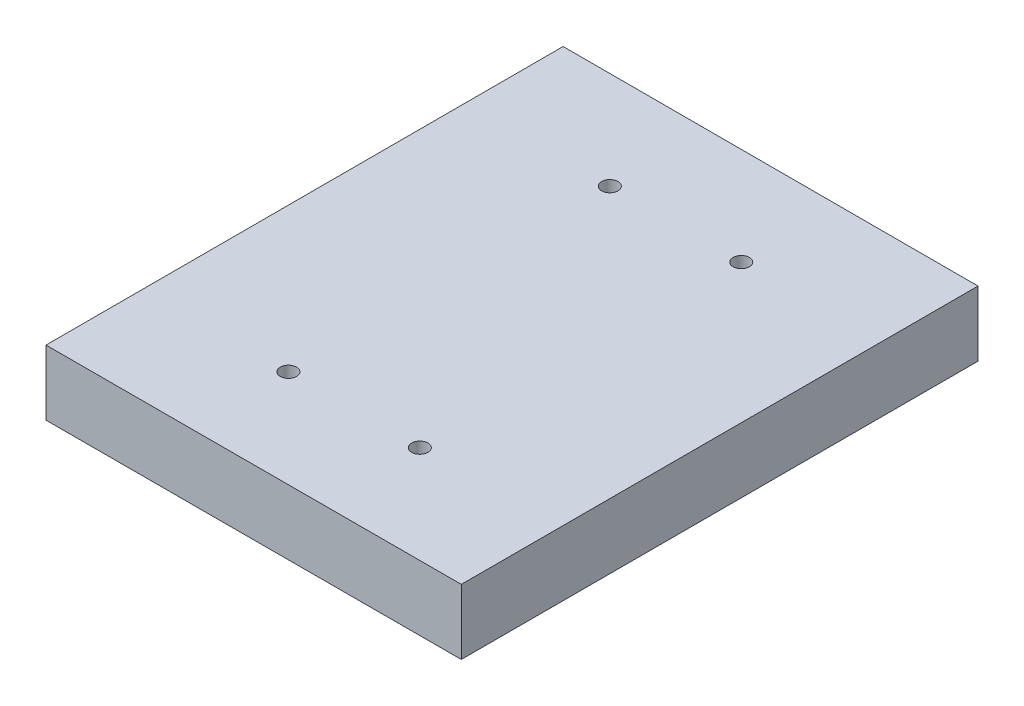
from build123d import *

# Parameters (mm, degrees)
SKETCH1_R           = 1.25
BOSS_EXTRUDE2_DEPTH = 10
SKETCH3_R           = 2.5
CUT_EXTRUDE2_DEPTH  = 2


with BuildPart() as part:
    # Sketch1 → Boss-Extrude2 (new body)
    with BuildSketch(Plane(origin=(0, 0, 0), x_dir=(1, 0, 0), z_dir=(0, 1, 0))):
        Polygon((7.491574944, 45.496576397), (-56.267168264, 45.496576397), (-56.267168264, -33.972048376), (7.491574944, -33.906823563), align=None)
        with Locations(Location((-34.087168277, -18.903423613, 0), (0, 0, 270))):
            Circle(SKETCH1_R, mode=Mode.SUBTRACT)
        with Locations(Location((-13.887168277, -18.903423613, 0), (0, 0, 270))):
            Circle(SKETCH1_R, mode=Mode.SUBTRACT)
        with Locations(Location((-34.087168277, 30.496576397, 0), (0, 0, 270))):
            Circle(SKETCH1_R, mode=Mode.SUBTRACT)
        with Locations(Location((-13.887168277, 30.496576397, 0), (0, 0, 270))):
            Circle(SKETCH1_R, mode=Mode.SUBTRACT)
    extrude(amount=-BOSS_EXTRUDE2_DEPTH)

    # Sketch3 → Cut-Extrude2 (cut)
    with BuildSketch(Plane.XZ.offset(10)):
        with Locations(Location((-13.887168277, 18.903423613, 0), (0, 0, 270))):
            Circle(SKETCH3_R)
        with Locations(Location((-34.087168277, 18.903423613, 0), (0, 0, 270))):
            Circle(SKETCH3_R)
        with Locations(Location((-13.887168277, -30.496576397, 0), (0, 0, 270))):
            Circle(SKETCH3_R)
        with Locations(Location((-34.087168277, -30.496576397, 0), (0, 0, 270))):
            Circle(SKETCH3_R)
    extrude(amount=-CUT_EXTRUDE2_DEPTH, mode=Mode.SUBTRACT)


solid = part.part
